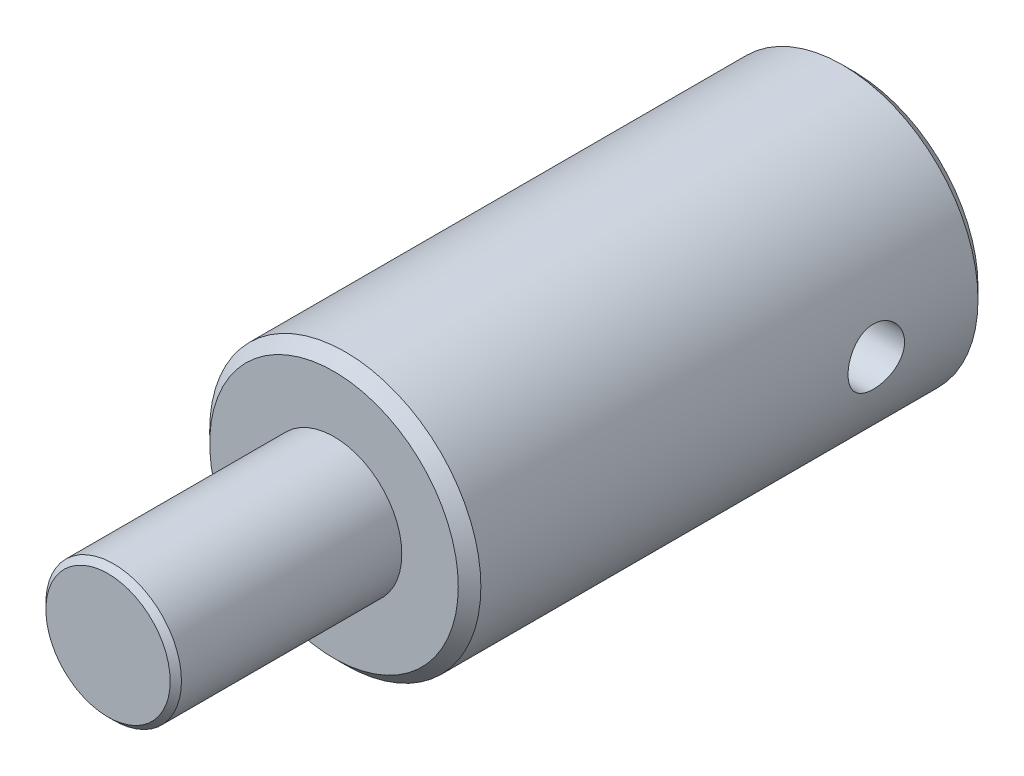
from build123d import *

# Parameters (mm, degrees)
SKETCH1_R               = 6
BOSS_EXTRUDE1_DEPTH     = 23
SKETCH2_R               = 3
BOSS_EXTRUDE2_DEPTH     = 10
CHAMFER1_SIZE           = 0.5
CHAMFER2_SIZE           = 0.25
CUT_EXTRUDE1_DEPTH      = 35.073450075
CUT_EXTRUDE1_DEPTH_BACK = 35.073450075
SKETCH4_R               = 1.25


with BuildPart() as part:
    # Sketch1 → Boss-Extrude1 (new body)
    with BuildSketch(Plane.XY):
        Circle(SKETCH1_R)
    extrude(amount=BOSS_EXTRUDE1_DEPTH)

    # Sketch2 → Boss-Extrude2 (add)
    with BuildSketch(Plane.XY.offset(23)):
        Circle(SKETCH2_R)
    extrude(amount=BOSS_EXTRUDE2_DEPTH)

    # Chamfer1
    chamfer1_edges = [part.edges().sort_by_distance(p)[0] for p in [
        (-6, 0, 0),
        (-6, 0, 23),
    ]]
    chamfer(chamfer1_edges, length=CHAMFER1_SIZE)

    # Chamfer2
    chamfer2_edges = [part.edges().sort_by_distance(p)[0] for p in [
        (-3, 0, 33),
    ]]
    chamfer(chamfer2_edges, length=CHAMFER2_SIZE)

    # Sketch4 → Cut-Extrude1 (cut, two sides: drawn at the far end of the back side and taken through both)
    with BuildSketch(Plane(origin=(0, 0, 0), x_dir=(0, 0, -1), z_dir=(1, 0, 0)).offset(-CUT_EXTRUDE1_DEPTH_BACK)):
        with Locations((-5, 0)):
            Circle(SKETCH4_R)
    extrude(amount=CUT_EXTRUDE1_DEPTH + CUT_EXTRUDE1_DEPTH_BACK, mode=Mode.SUBTRACT)


solid = part.part
